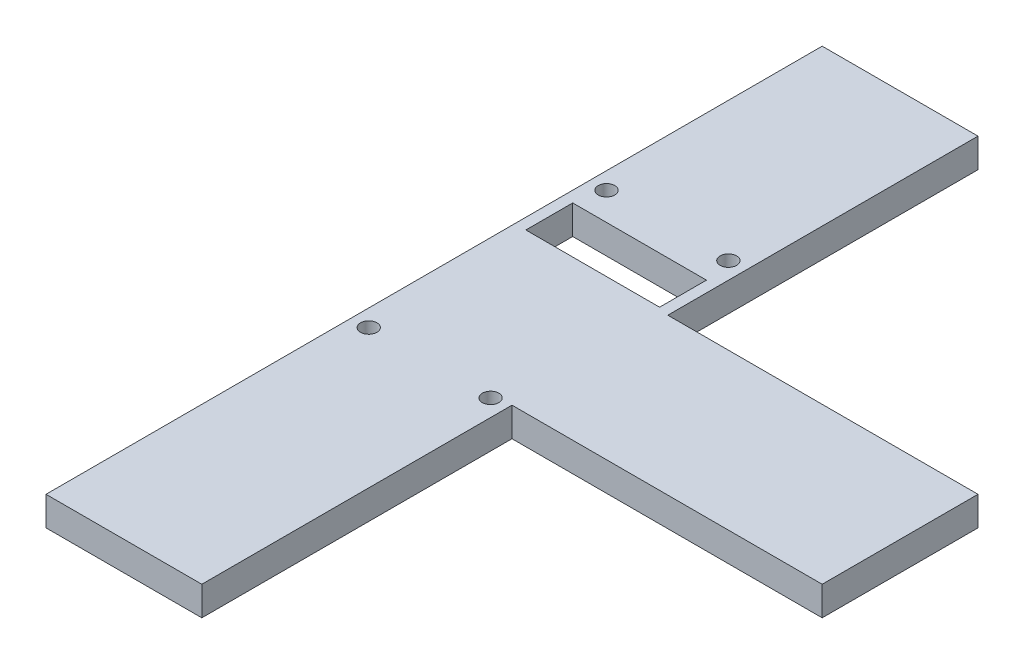
from build123d import *

# Parameters (mm, degrees)
SKETCH21_R           = 1.7
SKETCH21_W           = 27.57
SKETCH21_H           = 9.66
BOSS_EXTRUDE18_DEPTH = 6


with BuildPart() as part:
    # Sketch21 → Boss-Extrude18 (new body)
    with BuildSketch(Plane(origin=(0, 0, 0), x_dir=(1, 0, 0), z_dir=(0, 1, 0))):
        Polygon((-16.06, -12.06), (-16.06, 20.06), (-16.06, 84), (0, 84), (16.06, 84), (16.06, 20.06), (80, 20.06), (80, 4), (80, -12.06), (16.06, -12.06), (16.06, -76), (0, -76), (-16.06, -76), align=None)
        with Locations(Location((-12.56, 36.04, 0), (0, 0, 270))):
            Circle(SKETCH21_R, mode=Mode.SUBTRACT)
        with Locations(Location((12.56, 36.04, 0), (0, 0, 270))):
            Circle(SKETCH21_R, mode=Mode.SUBTRACT)
        with Locations(Location((12.56, -12.97, 0), (0, 0, 270))):
            Circle(SKETCH21_R, mode=Mode.SUBTRACT)
        with Locations(Location((-12.56, -12.97, 0), (0, 0, 270))):
            Circle(SKETCH21_R, mode=Mode.SUBTRACT)
        with Locations((0, 25.47)):
            Rectangle(SKETCH21_W, SKETCH21_H, mode=Mode.SUBTRACT)
    extrude(amount=BOSS_EXTRUDE18_DEPTH)


solid = part.part
